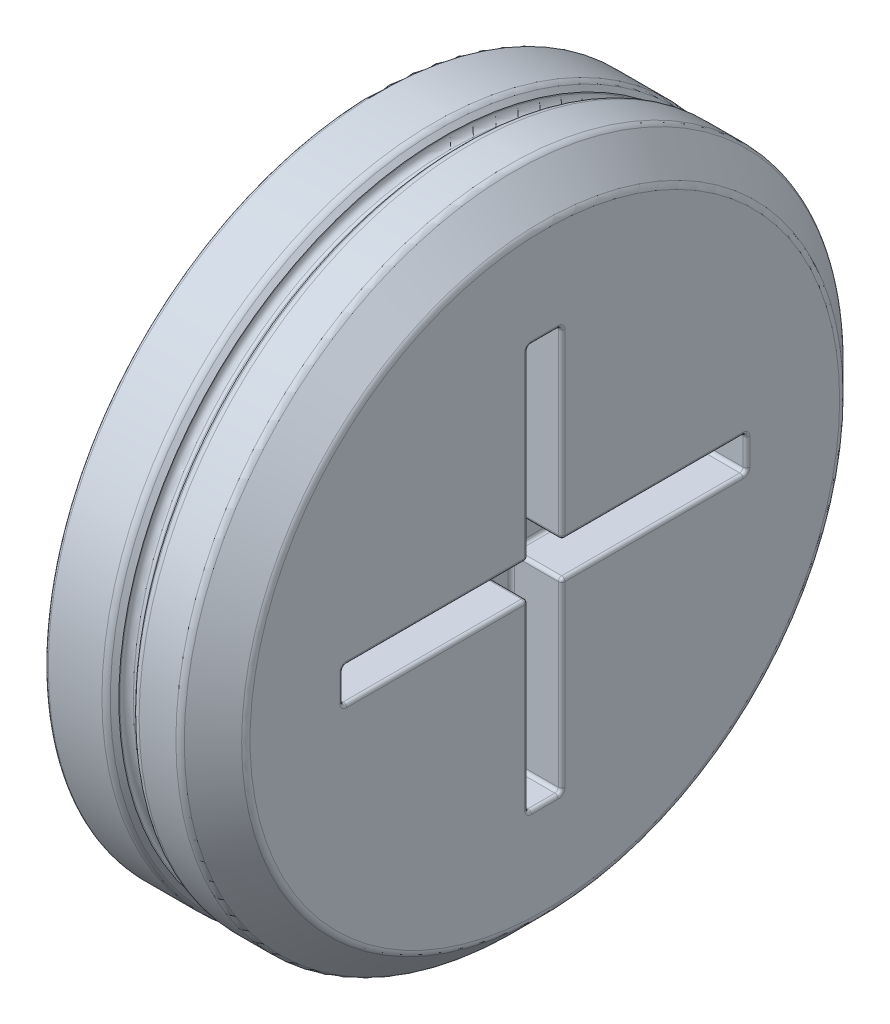
from build123d import *

# Parameters (mm, degrees)
SKETCH1_R           = 9.875
SKETCH1_R_2         = 8.875
BOSS_EXTRUDE1_DEPTH = 2
SKETCH2_R           = 8.875
BOSS_EXTRUDE2_DEPTH = 0.5
SKETCH3_R           = 9.443237681
BOSS_EXTRUDE4_DEPTH = 0.5
BOSS_EXTRUDE5_START = 2.5
SKETCH4_R           = 9.875
BOSS_EXTRUDE5_DEPTH = 2.5
CHAMFER1_SIZE       = 0.2
FILLET1_R           = 0.2
CHAMFER2_SIZE       = 1
FILLET3_R           = 0.25
FILLET4_R           = 0.25
SKETCH5_W           = 1
SKETCH5_H           = 1
SKETCH5_H_2         = 5.5
SKETCH5_W_2         = 5.5
CUT_EXTRUDE1_DEPTH  = 1.5
FILLET5_R           = 0.1
FILLET6_R           = 0.1


with BuildPart() as part:
    # Sketch1 → Boss-Extrude1 (new body)
    with BuildSketch(Plane(origin=(0, 0, 0), x_dir=(0, 0, -1), z_dir=(1, 0, 0))):
        Circle(SKETCH1_R)
        Circle(SKETCH1_R_2, mode=Mode.SUBTRACT)
    extrude(amount=-BOSS_EXTRUDE1_DEPTH)

    # Sketch2 → Boss-Extrude2 (add)
    with BuildSketch(Plane(origin=(0, 0, 0), x_dir=(0, 0, -1), z_dir=(1, 0, 0))):
        Circle(SKETCH2_R)
    extrude(amount=-BOSS_EXTRUDE2_DEPTH)

    # Sketch3 → Boss-Extrude4 (add)
    with BuildSketch(Plane(origin=(0, 0, 0), x_dir=(0, 0, -1), z_dir=(1, 0, 0))):
        Circle(SKETCH3_R)
    extrude(amount=BOSS_EXTRUDE4_DEPTH)

    # Sketch4 → Boss-Extrude5 (add)
    with BuildSketch(Plane(origin=(0.5, 0, 0), x_dir=(0, 0, -1), z_dir=(1, 0, 0)).offset(BOSS_EXTRUDE5_START)):
        Circle(SKETCH4_R)
    extrude(amount=-BOSS_EXTRUDE5_DEPTH)

    # Chamfer1
    chamfer1_edges = [part.edges().sort_by_distance(p)[0] for p in [
        (0, 0, 9.875),
        (0.5, 0, 9.875),
    ]]
    chamfer(chamfer1_edges, length=CHAMFER1_SIZE)

    # Fillet1
    fillet1_edges = [part.edges().sort_by_distance(p)[0] for p in [
        (0, 0, 9.443237681),
        (0.5, 0, 9.443237681),
    ]]
    fillet(fillet1_edges, radius=FILLET1_R)

    # Chamfer2
    chamfer2_edges = [part.edges().sort_by_distance(p)[0] for p in [
        (3, 0, 9.875),
    ]]
    chamfer(chamfer2_edges, length=CHAMFER2_SIZE)

    # Fillet3
    fillet3_edges = [part.edges().sort_by_distance(p)[0] for p in [
        (3, 0, 8.875),
        (2, 0, 9.875),
    ]]
    fillet(fillet3_edges, radius=FILLET3_R)

    # Fillet4
    fillet4_edges = [part.edges().sort_by_distance(p)[0] for p in [
        (0.7, 0, 9.875),
        (-0.2, 0, 9.875),
    ]]
    fillet(fillet4_edges, radius=FILLET4_R)

    # Sketch5 → Cut-Extrude1 (cut)
    with BuildSketch(Plane(origin=(3, 0, 0), x_dir=(0, 0, -1), z_dir=(1, 0, 0))):
        Rectangle(SKETCH5_W, SKETCH5_H)
        with Locations((0, -3.25)):
            Rectangle(SKETCH5_W, SKETCH5_H_2)
        with Locations((3.25, 0)):
            Rectangle(SKETCH5_W_2, SKETCH5_H)
        with Locations((0, 3.25)):
            Rectangle(SKETCH5_W, SKETCH5_H_2)
        with Locations((-3.25, 0)):
            Rectangle(SKETCH5_W_2, SKETCH5_H)
    extrude(amount=-CUT_EXTRUDE1_DEPTH, mode=Mode.SUBTRACT)

    # Fillet5
    fillet5_edges = [part.edges().sort_by_distance(p)[0] for p in [
        (1.5, -0.5, 3.25),
        (2.25, -0.5, 0.5),
        (3, 0, 6),
        (2.25, -0.5, 6),
        (3, 0.5, 3.25),
        (2.25, 0.5, 6),
        (3, 3.25, 0.5),
        (2.25, 0.5, 0.5),
        (3, 6, 0),
        (2.25, 6, 0.5),
        (1.5, 3.25, -0.5),
        (2.25, 6, -0.5),
        (3, 0.5, -3.25),
        (2.25, 0.5, -0.5),
        (1.5, 0, -6),
        (2.25, 0.5, -6),
        (1.5, -0.5, -3.25),
        (2.25, -0.5, -6),
        (1.5, -3.25, -0.5),
        (2.25, -0.5, -0.5),
        (1.5, -6, 0),
        (2.25, -6, -0.5),
        (3, -3.25, 0.5),
        (2.25, -6, 0.5),
        (1.5, 0, 6),
        (1.5, 0.5, 3.25),
        (1.5, 3.25, 0.5),
        (1.5, 6, 0),
        (1.5, 0.5, -3.25),
        (1.5, -3.25, 0.5),
        (3, -0.5, 3.25),
        (3, -6, 0),
        (3, -3.25, -0.5),
        (3, -0.5, -3.25),
        (3, 0, -6),
        (3, 3.25, -0.5),
    ]]
    fillet(fillet5_edges, radius=FILLET5_R)

    # Fillet6
    fillet6_edges = [part.edges().sort_by_distance(p)[0] for p in [
        (-2, 0, 9.875),
    ]]
    fillet(fillet6_edges, radius=FILLET6_R)


solid = part.part
